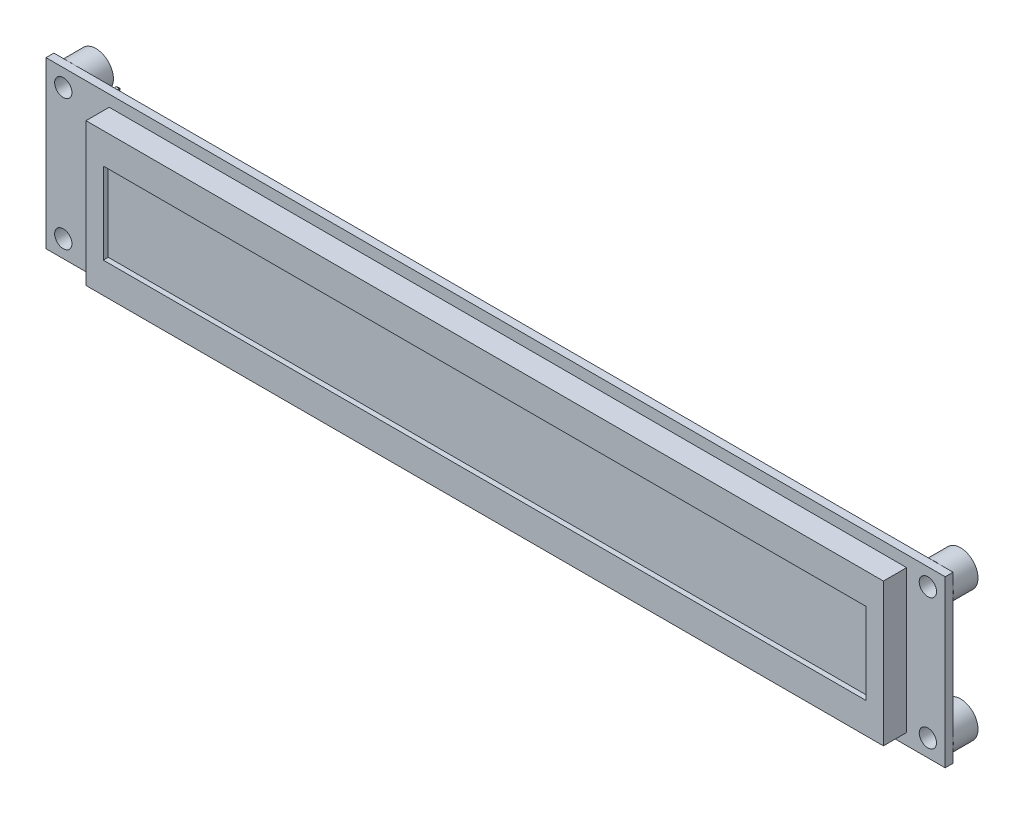
from build123d import *

# Parameters (mm, degrees)
SKETCH_2_W                          = 182
SKETCH_2_H                          = 33.5
EXTRUDE_1_DEPTH                     = 1.6
SKETCH_3_W                          = 161.4
SKETCH_3_H                          = 28.9
EXTRUDE_2_DEPTH                     = 4.7
SKETCH_4_W                          = 154.4
SKETCH_4_H                          = 16.5
CUT_EXTRUDE_1_DEPTH                 = 1
SKETCH_6_R                          = 3.55
EXTRUDE_3_DEPTH                     = 5
SKETCH_5_R                          = 1.75
CUT_EXTRUDE_2_DEPTH                 = 93.821885889
SKETCH_7_W                          = 0.64
SKETCH_7_H                          = 0.64
EXTRUDE_4_DEPTH                     = 3.2
CHAMFER_1_SIZE                      = 0.2
CHAMFER_1_SIZE2                     = 0.307972993
SKETCH_9_W                          = 5
SKETCH_9_H                          = 20.32
EXTRUDE_5_DEPTH                     = 5
PATTERN_LINEAR_6_COUNT              = 8
PATTERN_LINEAR_6_PITCH              = 2.54
PATTERN_LINEAR_6_COUNT_DIR2         = 2
PATTERN_LINEAR_6_PITCH_DIR2         = 2.54
CHAMFER_1_OF_PATTERN_LINEAR_6_SIZE2 = 0.2
CHAMFER_1_OF_PATTERN_LINEAR_6_SIZE  = 0.307972993


with BuildPart() as part:
    # Эскиз2 → Бобышка-Вытянуть1 (new body)
    with BuildSketch(Plane.XY.offset(5)):
        Rectangle(SKETCH_2_W, SKETCH_2_H)
    extrude(amount=EXTRUDE_1_DEPTH)

    # Эскиз3 → Бобышка-Вытянуть2 (add)
    with BuildSketch(Plane.XY.offset(6.6)):
        with Locations((2.5, 0)):
            Rectangle(SKETCH_3_W, SKETCH_3_H)
    extrude(amount=EXTRUDE_2_DEPTH)

    # Эскиз4 → Вырез-Вытянуть1 (cut)
    with BuildSketch(Plane.XY.offset(11.3)):
        with Locations((2.5, 0)):
            Rectangle(SKETCH_4_W, SKETCH_4_H)
    extrude(amount=-CUT_EXTRUDE_1_DEPTH, mode=Mode.SUBTRACT)

    # Эскиз6 → Бобышка-Вытянуть3 (add)
    with BuildSketch(Plane(origin=(0, 0, 5), x_dir=(-1, 0, 0), z_dir=(0, 0, -1))):
        with Locations(Location((-87.5, -13.25, 0), (0, 0, 189.627632683))):
            Circle(SKETCH_6_R)
        with Locations(Location((-87.5, 13.25, 0), (0, 0, 170.372367317))):
            Circle(SKETCH_6_R)
        with Locations(Location((87.5, 13.25, 0), (0, 0, 99.627632683))):
            Circle(SKETCH_6_R)
        with Locations(Location((87.5, -13.25, 0), (0, 0, 260.372367317))):
            Circle(SKETCH_6_R)
    extrude(amount=EXTRUDE_3_DEPTH)

    # Эскиз5 → Вырез-Вытянуть2 (cut, through all)
    with BuildSketch(Plane.XY.offset(6.6)):
        with Locations((-87.5, 13.25)):
            Circle(SKETCH_5_R)
        with Locations((-87.5, -13.25)):
            Circle(SKETCH_5_R)
        with Locations((87.5, -13.25)):
            Circle(SKETCH_5_R)
        with Locations((87.5, 13.25)):
            Circle(SKETCH_5_R)
    extrude(amount=-CUT_EXTRUDE_2_DEPTH, mode=Mode.SUBTRACT)



with BuildPart() as body_2:
    # Эскиз7 → Бобышка-Вытянуть4 (new body)
    with BuildSketch(Plane.XY):
        with Locations((-88.5, -8.83)):
            Rectangle(SKETCH_7_W, SKETCH_7_H)
    extrude_4 = extrude(amount=-EXTRUDE_4_DEPTH)

    # Фаска1
    chamfer_1_edges = [body_2.edges().sort_by_distance(p)[0] for p in [
        (-88.18, -8.83, -3.2),
        (-88.5, -8.51, -3.2),
        (-88.82, -8.83, -3.2),
        (-88.5, -9.15, -3.2),
    ]]
    chamfer_1_side = [body_2.faces().sort_by_distance(p)[0] for p in [
        (-88.5, -8.83, -3.2),
    ]]
    chamfer(chamfer_1_edges, length=CHAMFER_1_SIZE, length2=CHAMFER_1_SIZE2, reference=chamfer_1_side[0])


with BuildPart() as part_1:
    add(part.part)

    add(body_2.part)  # Бобышка-Вытянуть5 merges body 2
    # Эскиз9 → Бобышка-Вытянуть5 (add)
    with BuildSketch(Plane.XY):
        with Locations((-87.23, 0)):
            Rectangle(SKETCH_9_W, SKETCH_9_H)
    extrude(amount=EXTRUDE_5_DEPTH)

    # Линейный массив6: Extrude 4 8 × 2
    with Locations(*[(j * PATTERN_LINEAR_6_PITCH_DIR2, i * PATTERN_LINEAR_6_PITCH, 0) for i in range(PATTERN_LINEAR_6_COUNT) for j in range(PATTERN_LINEAR_6_COUNT_DIR2) if (i, j) != (0, 0)]):
        add(extrude_4)

    # Фаска1 of Линейный массив6
    chamfer_1_of_pattern_linear_6_edges = [part_1.edges().sort_by_distance(p)[0] for p in [
        (-85.64, -8.83, -3.2),
        (-85.96, -8.51, -3.2),
        (-86.28, -8.83, -3.2),
        (-85.96, -9.15, -3.2),
        (-88.18, -6.29, -3.2),
        (-88.5, -5.97, -3.2),
        (-88.82, -6.29, -3.2),
        (-88.5, -6.61, -3.2),
        (-85.64, -6.29, -3.2),
        (-85.96, -5.97, -3.2),
        (-86.28, -6.29, -3.2),
        (-85.96, -6.61, -3.2),
        (-88.18, -3.75, -3.2),
        (-88.5, -3.43, -3.2),
        (-88.82, -3.75, -3.2),
        (-88.5, -4.07, -3.2),
        (-85.64, -3.75, -3.2),
        (-85.96, -3.43, -3.2),
        (-86.28, -3.75, -3.2),
        (-85.96, -4.07, -3.2),
        (-88.18, -1.21, -3.2),
        (-88.5, -0.89, -3.2),
        (-88.82, -1.21, -3.2),
        (-88.5, -1.53, -3.2),
        (-85.64, -1.21, -3.2),
        (-85.96, -0.89, -3.2),
        (-86.28, -1.21, -3.2),
        (-85.96, -1.53, -3.2),
        (-88.18, 1.33, -3.2),
        (-88.5, 1.65, -3.2),
        (-88.82, 1.33, -3.2),
        (-88.5, 1.01, -3.2),
        (-85.64, 1.33, -3.2),
        (-85.96, 1.65, -3.2),
        (-86.28, 1.33, -3.2),
        (-85.96, 1.01, -3.2),
        (-88.18, 3.87, -3.2),
        (-88.5, 4.19, -3.2),
        (-88.82, 3.87, -3.2),
        (-88.5, 3.55, -3.2),
        (-85.64, 3.87, -3.2),
        (-85.96, 4.19, -3.2),
        (-86.28, 3.87, -3.2),
        (-85.96, 3.55, -3.2),
        (-88.18, 6.41, -3.2),
        (-88.5, 6.73, -3.2),
        (-88.82, 6.41, -3.2),
        (-88.5, 6.09, -3.2),
        (-85.64, 6.41, -3.2),
        (-85.96, 6.73, -3.2),
        (-86.28, 6.41, -3.2),
        (-85.96, 6.09, -3.2),
        (-88.18, 8.95, -3.2),
        (-88.5, 9.27, -3.2),
        (-88.82, 8.95, -3.2),
        (-88.5, 8.63, -3.2),
        (-85.64, 8.95, -3.2),
        (-85.96, 9.27, -3.2),
        (-86.28, 8.95, -3.2),
        (-85.96, 8.63, -3.2),
    ]]
    chamfer(chamfer_1_of_pattern_linear_6_edges, length=CHAMFER_1_OF_PATTERN_LINEAR_6_SIZE, length2=CHAMFER_1_OF_PATTERN_LINEAR_6_SIZE2)


solid = part_1.part
